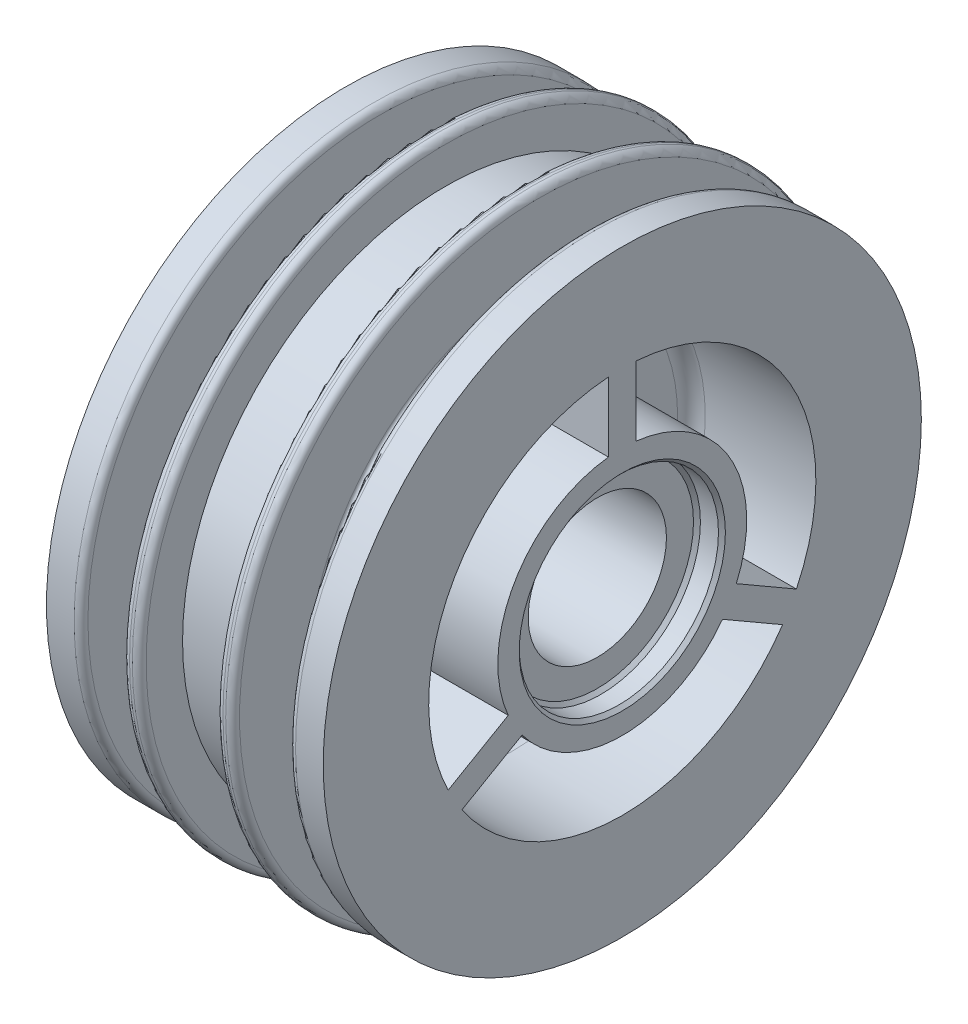
from build123d import *

# Parameters (mm, degrees)
CHAFL_N1_SIZE     = 0.25
REDONDEO1_R       = 0.5
RIB2_REACH        = 39.2
SKETCH4_WALLS_W   = 2
SKETCH4_WALLS_H   = 84.196532302
CIRPATTERN2_COUNT = 3
RIB3_REACH        = 39.2
SKETCH5_WALLS_W   = 2
SKETCH5_WALLS_H   = 83.624400687
CIRPATTERN3_COUNT = 3
FILLET4_R         = 1
FILLET5_R         = 1
CHAFL_N2_SIZE     = 0.25
REDONDEO3_R       = 0.25


with BuildPart() as part:
    # Sketch1 → Revolución1 (revolve)
    with BuildSketch(Plane.XY, mode=Mode.PRIVATE) as revoluci_n1_sk:
        Polygon((-67.349324085, 21.627771976), (-69.849324085, 21.627771976), (-69.849324085, 16.5), (-73.349324085, 16.5), (-73.349324085, 22.179232841), (-74.549324085, 22.179232841), (-74.549324085, 19), (-80.149324085, 19), (-80.149324085, 22.133824487), (-81.349324085, 22.133824487), (-81.349324085, 16.5), (-84.849324085, 16.5), (-84.849324085, 21.641860401), (-87.349324085, 21.641860401), (-87.349324085, 14), (-78.349324085, 14), (-78.349324085, 9), (-87.349324085, 9), (-87.349324085, 7.2074675), (-85.778847005, 7.2074675), (-85.778847005, 5), (-84.208369925, 5), (-84.208369925, 6), (-81.408369925, 6), (-81.408369925, 5), (-69.155872635, 5), (-69.155872635, 7.2074675), (-67.349324085, 7.2074675), (-67.349324085, 9), (-76.349324085, 9), (-76.349324085, 14), (-67.349324085, 14), align=None)
    revolve(revoluci_n1_sk.sketch.rotate(Axis((0, 0, 0), (-1, 0, 0)), 90), axis=Axis((0, 0, 0), (-1, 0, 0)))

    # Chaflán1
    chafl_n1_edges = [part.edges().sort_by_distance(p)[0] for p in [
        (-81.408369925, 0, 5),
        (-81.408369925, 0, 6),
        (-84.208369925, 0, 6),
        (-84.208369925, 0, 5),
    ]]
    chamfer(chafl_n1_edges, length=CHAFL_N1_SIZE)

    # Redondeo1
    redondeo1_edges = [part.edges().sort_by_distance(p)[0] for p in [
        (-84.849324085, 0, 21.641860401),
        (-81.349324085, 0, 22.133824487),
        (-80.149324085, 0, 22.133824487),
        (-74.549324085, 0, 22.179232841),
        (-73.349324085, 0, 22.179232841),
        (-69.849324085, 0, 21.627771976),
    ]]
    fillet(redondeo1_edges, radius=REDONDEO1_R)

    # Sketch4 walls → Rib2 (add, up to next)
    with BuildSketch(Plane.ZY.offset(87.349324085), mode=Mode.PRIVATE) as rib2_sk1:
        with Locations((-1, 11.580129465)):
            Rectangle(SKETCH4_WALLS_W, SKETCH4_WALLS_H)
    rib2_tool1 = extrude(rib2_sk1.sketch, amount=-RIB2_REACH, mode=Mode.PRIVATE) - part.part
    rib2 = rib2_tool1.solids().sort_by_distance((-87.349324085, 11.580129465, 0))[0]
    add(rib2)

    # CirPattern2: Rib2 ×3 about axis
    cirpattern2_axis = Axis((0, 0, 0), (1, 0, 0))
    for i in range(1, CIRPATTERN2_COUNT):
        add(rib2.rotate(cirpattern2_axis, i * 360 / CIRPATTERN2_COUNT))

    # Sketch5 walls → Rib3 (add, up to next)
    with BuildSketch(Plane(origin=(-67.349324085, 0, 0), x_dir=(0, 0, -1), z_dir=(1, 0, 0)), mode=Mode.PRIVATE) as rib3_sk1:
        with Locations((0, 11.495900795)):
            Rectangle(SKETCH5_WALLS_W, SKETCH5_WALLS_H)
    rib3_tool1 = extrude(rib3_sk1.sketch, amount=-RIB3_REACH, mode=Mode.PRIVATE) - part.part
    rib3 = rib3_tool1.solids().sort_by_distance((-67.349324085, 11.495900795, 0))[0]
    add(rib3)

    # CirPattern3: Rib3 ×3 about axis
    cirpattern3_axis = Axis((0, 0, 0), (1, 0, 0))
    for i in range(1, CIRPATTERN3_COUNT):
        add(rib3.rotate(cirpattern3_axis, i * 360 / CIRPATTERN3_COUNT))

    # Fillet4
    fillet4_edges = [part.edges().sort_by_distance(p)[0] for p in [
        (-82.849324085, 8.774964387, -2),
        (-82.849324085, 13.856406461, -2),
        (-82.849324085, 14, 0),
        (-82.849324085, 9, 0),
        (-82.849324085, -6.119533001, -6.599342077),
        (-82.849324085, -8.660254038, -11),
        (-82.849324085, -7, -12.124355653),
        (-82.849324085, -4.5, -7.794228634),
        (-82.849324085, -2.655431386, 8.599342077),
        (-82.849324085, -5.196152423, 13),
        (-82.849324085, -7, 12.124355653),
        (-82.849324085, -4.5, 7.794228634),
    ]]
    fillet(fillet4_edges, radius=FILLET4_R)

    # Fillet5
    fillet5_edges = [part.edges().sort_by_distance(p)[0] for p in [
        (-76.349324085, 7, 12.124355653),
        (-76.349324085, 4.5, 7.794228634),
        (-76.349324085, 11.454255977, 1),
        (-76.349324085, 11.454255977, -1),
        (-76.349324085, 7, -12.124355653),
        (-76.349324085, 4.5, -7.794228634),
        (-76.349324085, -4.861102585, -10.419676657),
        (-76.349324085, -6.593153392, -9.419676657),
        (-76.349324085, -14, 0),
        (-76.349324085, -9, 0),
        (-76.349324085, -6.593153392, 9.419676657),
        (-76.349324085, -4.861102585, 10.419676657),
        (-78.349324085, -5.727838942, 9.920908065),
        (-78.349324085, -13.957504991, 1.089979097),
        (-78.349324085, -7.279176471, -8.607903486),
        (-78.349324085, -8.952981604, 0.918760248),
        (-78.349324085, -4.863290764, 7.906706392),
        (-78.349324085, -6.373756227, -6.65212117),
        (-78.349324085, -8.777777646, -10.443904207),
        (-78.349324085, -7.12531739, 11.70014418),
        (-78.349324085, 7.922702083, 11.542564347),
        (-78.349324085, -3.815074856, 10.607903486),
        (-78.349324085, 11.455677884, 0),
        (-78.349324085, 5.272160517, 7.294129385),
        (-78.349324085, 9.279053978, 0.258380151),
        (-78.349324085, 13.695280783, 0.32063378),
        (-78.349324085, -2.574027809, 8.845895395),
        (-78.349324085, -4.655797535, 12.823730534),
        (-78.349324085, 3.680821088, -8.212889633),
        (-78.349324085, 11.094251327, -2),
        (-78.349324085, 6.034802908, -12.632543444),
        (-78.349324085, -5.727838942, -9.920908065),
        (-78.349324085, 13.433575181, -2.379826327),
        (-78.349324085, -4.415763214, -8.165086544),
        (-78.349324085, -6.569963393, -12.020777959),
        (-78.349324085, 8.947784036, -2.193774225),
    ]]
    fillet(fillet5_edges, radius=FILLET5_R)

    # Chaflán2
    chafl_n2_edges = [part.edges().sort_by_distance(p)[0] for p in [
        (-69.155872635, 0, 7.2074675),
        (-85.778847005, 0, 7.2074675),
        (-87.349324085, 0, 7.2074675),
        (-67.349324085, 0, 7.2074675),
    ]]
    chamfer(chafl_n2_edges, length=CHAFL_N2_SIZE)

    # Redondeo3
    redondeo3_edges = [part.edges().sort_by_distance(p)[0] for p in [
        (-84.849324085, 0, 16.5),
        (-81.349324085, 0, 16.5),
        (-73.349324085, 0, 16.5),
        (-69.849324085, 0, 16.5),
    ]]
    fillet(redondeo3_edges, radius=REDONDEO3_R)


solid = part.part
